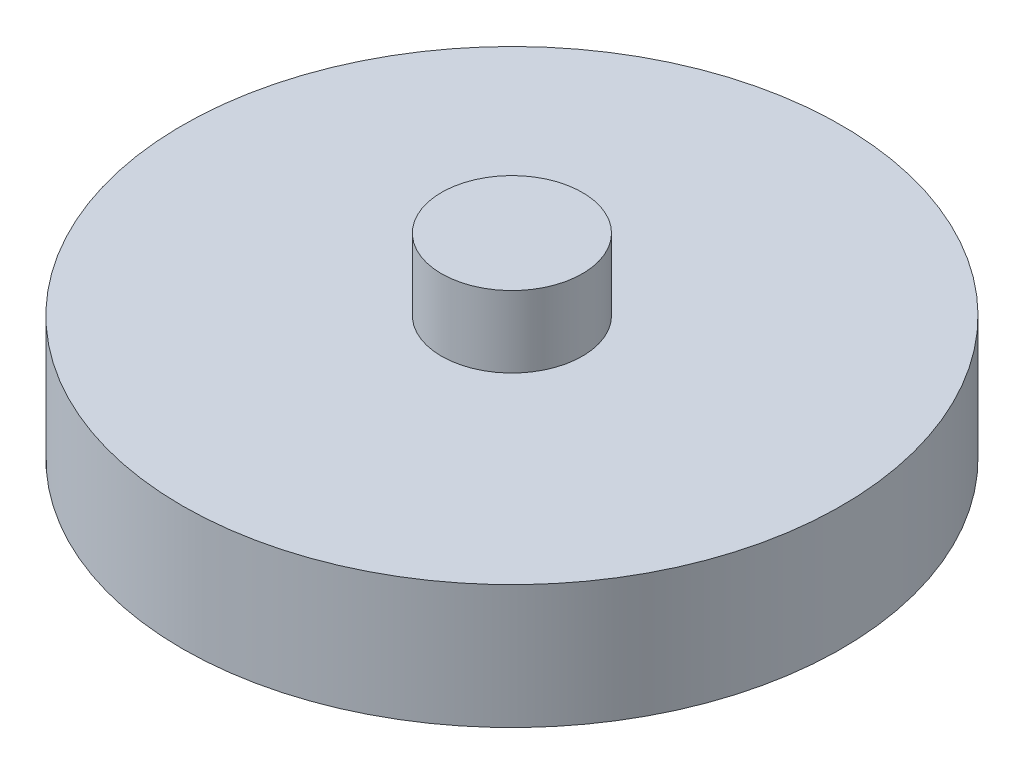
from build123d import *

# Parameters (mm, degrees)
SKETCH1_R           = 32.75
BOSS_EXTRUDE1_DEPTH = 12.3
SKETCH2_R           = 7
BOSS_EXTRUDE2_DEPTH = 7.1
SKETCH4_R           = 25
CUT_EXTRUDE1_DEPTH  = 3


with BuildPart() as part:
    # Sketch1 → Boss-Extrude1 (new body)
    with BuildSketch(Plane(origin=(0, 0, 0), x_dir=(1, 0, 0), z_dir=(0, 1, 0))):
        with Locations(Location((0, 0, 0), (0, 0, 270))):
            Circle(SKETCH1_R)
    extrude(amount=BOSS_EXTRUDE1_DEPTH)

    # Sketch2 → Boss-Extrude2 (add)
    with BuildSketch(Plane(origin=(0, 12.3, 0), x_dir=(1, 0, 0), z_dir=(0, 1, 0))):
        with Locations(Location((0, 0, 0), (0, 0, 270))):
            Circle(SKETCH2_R)
    extrude(amount=BOSS_EXTRUDE2_DEPTH)

    # Sketch4 → Cut-Extrude1 (cut)
    with BuildSketch(Plane.XZ):
        with Locations(Location((0, 0, 0), (0, 0, 270))):
            Circle(SKETCH4_R)
    extrude(amount=-CUT_EXTRUDE1_DEPTH, mode=Mode.SUBTRACT)


solid = part.part
